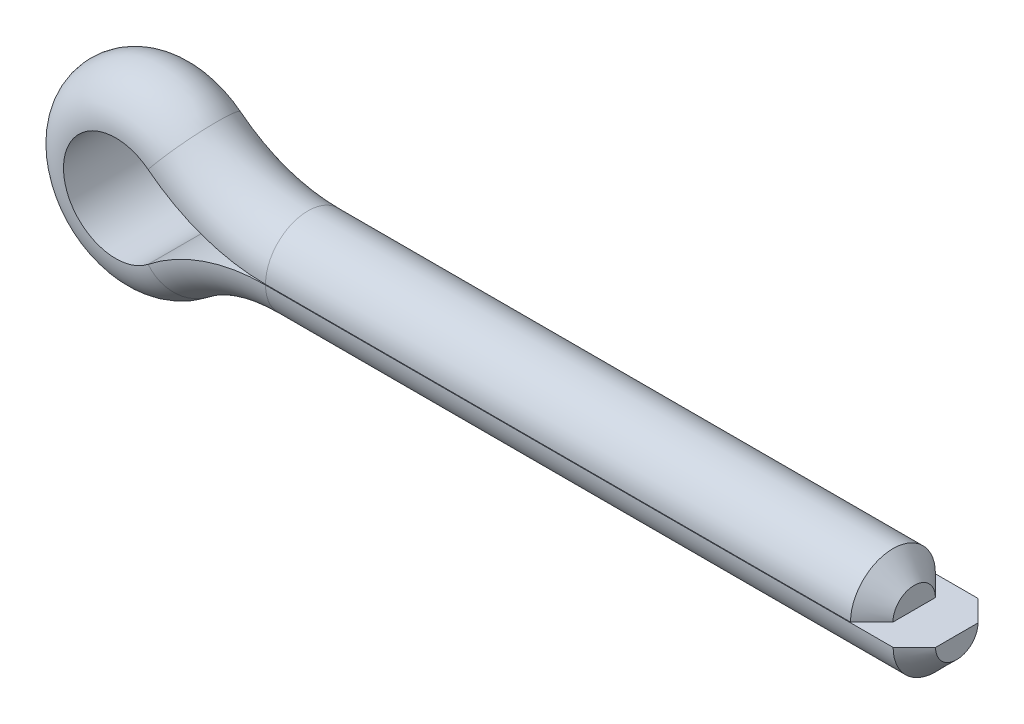
from build123d import *

# Parameters (mm, degrees)
CHAMFER1_SIZE = 1.778


with BuildPart() as part:
    # Sweep1: sweep along a path in Sketch1
    with BuildLine(Plane.XY) as sweep1_path:
        Line((3.571875, -0.0254), (-50.8, -0.0254))
        ThreePointArc((-50.8, -0.0254), (-56.005535978, -0.90313291), (-60.63544106, -3.439271473))
        ThreePointArc((-60.63544106, -3.439271473), (-67.731522792, 0), (-60.63544106, 3.439271473))
        ThreePointArc((-60.63544106, 3.439271473), (-56.005535978, 0.90313291), (-50.8, 0.0254))
        Line((-50.8, 0.0254), (0, 0.0254))
    # Sketch2 → Sweep1 (sweep)
    with BuildSketch(Plane(origin=(0, 0, 0), x_dir=(0, 0, -1), z_dir=(1, 0, 0))):
        with BuildLine():
            Line((-3.556, 0.0254), (3.556, 0.0254))
            ThreePointArc((3.556, 0.0254), (0, 3.5814), (-3.556, 0.0254))
        make_face()
    sweep(path=sweep1_path.line)

    # Chamfer1
    chamfer1_edges = [part.edges().sort_by_distance(p)[0] for p in [
        (3.571875, -3.5814, 0),
        (0, 3.5814, 0),
    ]]
    chamfer(chamfer1_edges, length=CHAMFER1_SIZE)


solid = part.part
